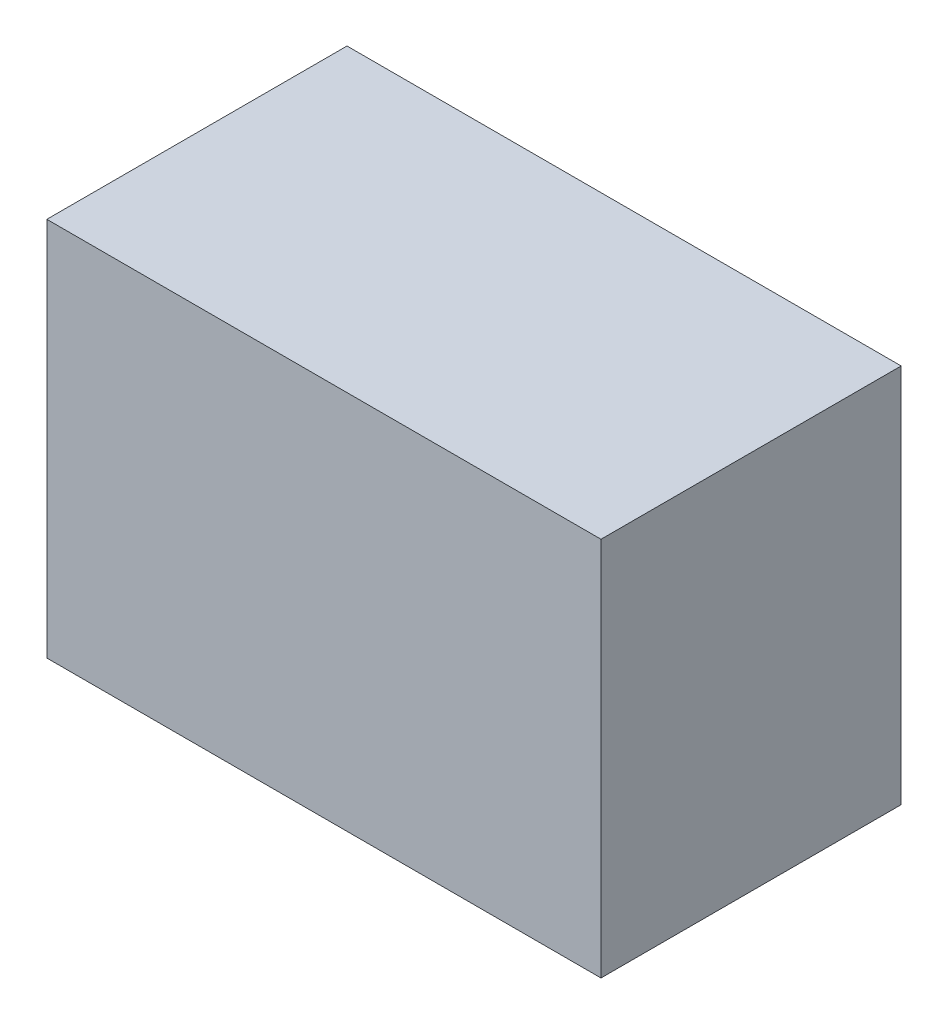
from build123d import *

# Parameters (mm, degrees)
SKETCH1_W           = 304.8
SKETCH1_H           = 165.1
BOSS_EXTRUDE1_DEPTH = 209


with BuildPart() as part:
    # Sketch1 → Boss-Extrude1 (new body)
    with BuildSketch(Plane(origin=(0, 0, 0), x_dir=(1, 0, 0), z_dir=(0, 1, 0))):
        with Locations((152.4, 82.55)):
            Rectangle(SKETCH1_W, SKETCH1_H)
    extrude(amount=BOSS_EXTRUDE1_DEPTH)


solid = part.part
